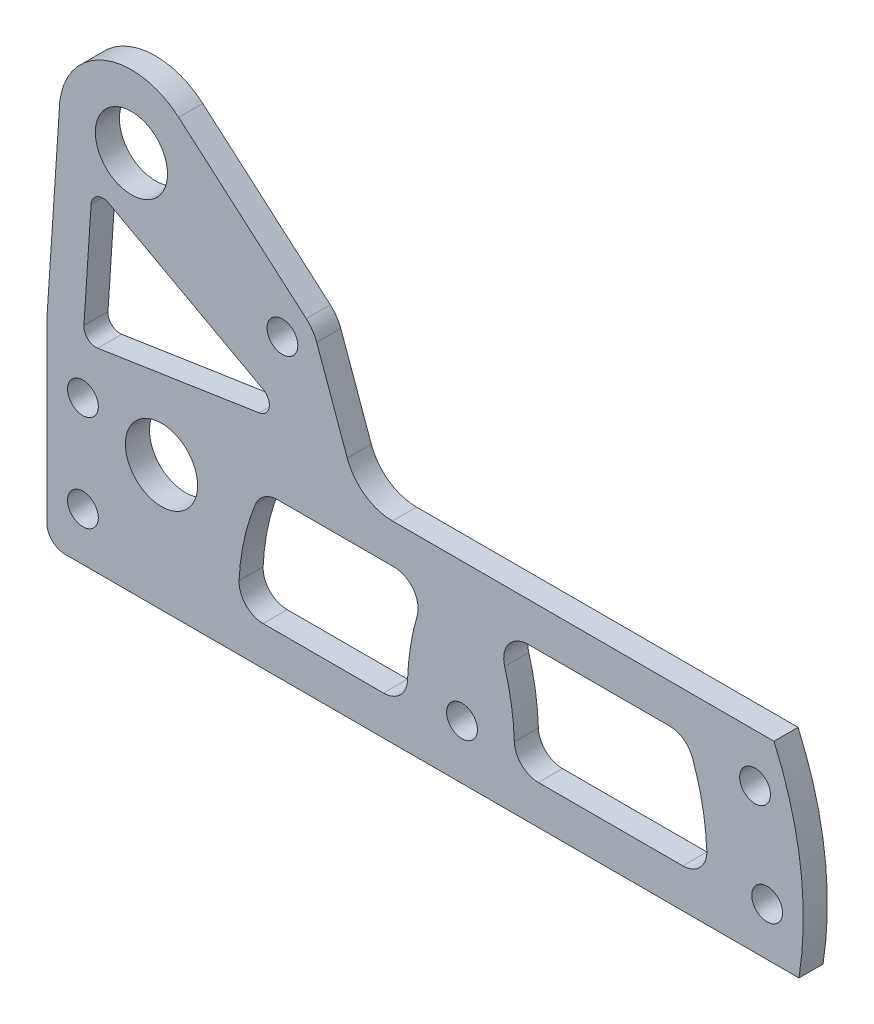
from build123d import *

# Parameters (mm, degrees)
SKETCH1_R           = 2.032
SKETCH1_R_2         = 4.7625
BOSS_EXTRUDE1_DEPTH = 3.175
FILLET1_R           = 6.35
SKETCH2_R           = 2.032
CUT_EXTRUDE1_DEPTH  = 116.854784776
FILLET2_R           = 2.3876
CUT_EXTRUDE2_REACH  = 117.855
FILLET3_R           = 3.175


with BuildPart() as part:
    # Sketch1 → Boss-Extrude1 (new body)
    with BuildSketch(Plane.XY):
        with BuildLine():
            Line((0, 0), (-99.21875, 0))
            Line((-99.21875, 0), (-99.21875, 25.4))
            ThreePointArc((-99.21875, 25.4), (-99.216112514, 25.559225204), (-99.208202949, 25.718275702))
            Line((-99.208202949, 25.718275702), (-97.583411312, 50.206818816))
            ThreePointArc((-97.583411312, 50.206818816), (-92.015151864, 58.871103506), (-81.820717516, 57.405207601))
            Line((-81.820717516, 57.405207601), (-64.992407125, 42.82279889))
            ThreePointArc((-64.992407125, 42.82279889), (-64.174703888, 41.906719209), (-63.615743119, 40.813374148))
            Line((-63.615743119, 40.813374148), (-58.084627995, 25.4))
            Line((-58.084627995, 25.4), (-3.297296565, 25.4))
            ThreePointArc((-3.297296565, 25.4), (0.195780415, 12.939434189), (0, 0))
        make_face()
        with Locations((-44.45, 7.14375)):
            Circle(SKETCH1_R, mode=Mode.SUBTRACT)
        with Locations((-84.089661312, 16.5735)):
            Circle(SKETCH1_R_2, mode=Mode.SUBTRACT)
        with Locations((-88.058411312, 50.206818816)):
            Circle(SKETCH1_R_2, mode=Mode.SUBTRACT)
        with Locations((-4.19910616, 6.35)):
            Circle(SKETCH1_R, mode=Mode.SUBTRACT)
        with Locations((-5.795027999, 19.05)):
            Circle(SKETCH1_R, mode=Mode.SUBTRACT)
        with Locations((-94.45625, 6.35)):
            Circle(SKETCH1_R, mode=Mode.SUBTRACT)
        with Locations((-94.45625, 19.05)):
            Circle(SKETCH1_R, mode=Mode.SUBTRACT)
    extrude(amount=BOSS_EXTRUDE1_DEPTH)

    # Fillet1
    fillet1_edges = [part.edges().sort_by_distance(p)[0] for p in [
        (-58.084627995, 25.4, 1.5875),
    ]]
    fillet(fillet1_edges, radius=FILLET1_R)

    # Sketch2 → Cut-Extrude1 (cut, through all)
    with BuildSketch(Plane.XY.offset(3.175)):
        with Locations((-68.140747312, 39.189568816)):
            Circle(SKETCH2_R)
    extrude(amount=-CUT_EXTRUDE1_DEPTH, mode=Mode.SUBTRACT)

    # Fillet2
    fillet2_edges = [part.edges().sort_by_distance(p)[0] for p in [
        (-99.21875, 0, 1.5875),
    ]]
    fillet(fillet2_edges, radius=FILLET2_R)

    # Sketch4 → Cut-Extrude2 (cut, up to next)
    with BuildSketch(Plane(origin=(0, 0, 0), x_dir=(-1, 0, 0), z_dir=(0, 0, -1)), mode=Mode.PRIVATE) as cut_extrude2_sk1:
        with BuildLine():
            Line((14.906243411, 20.25001426), (40.306243411, 20.25001426))
            ThreePointArc((40.306243411, 20.25001426), (38.03973616, 12.863437985), (37.591162137, 5.14998574))
            Line((37.591162137, 5.14998574), (12.191162137, 5.14998574))
            ThreePointArc((12.191162137, 5.14998574), (12.63973616, 12.863437985), (14.906243411, 20.25001426))
        make_face()
    cut_extrude2_tool1 = extrude(cut_extrude2_sk1.sketch, amount=-CUT_EXTRUDE2_REACH, mode=Mode.PRIVATE) & part.part
    # Sketch4 → Cut-Extrude2 (cut, up to next)
    with BuildSketch(Plane(origin=(0, 0, 0), x_dir=(-1, 0, 0), z_dir=(0, 0, -1)), mode=Mode.PRIVATE) as cut_extrude2_sk2:
        with BuildLine():
            Line((71.210862075, 28.952720027), (92.501475834, 25.698758848))
            ThreePointArc((92.501475834, 25.698758848), (93.814902604, 26.098604816), (94.325334391, 27.37313456))
            Line((94.325334391, 27.37313456), (93.375138804, 41.6942974))
            ThreePointArc((93.375138804, 41.6942974), (92.556554604, 42.979979171), (91.032400998, 42.983652428))
            Line((91.032400998, 42.983652428), (70.691982826, 31.916450766))
            ThreePointArc((70.691982826, 31.916450766), (69.886987798, 30.248228031), (71.210862075, 28.952720027))
        make_face()
    cut_extrude2_tool2 = extrude(cut_extrude2_sk2.sketch, amount=-CUT_EXTRUDE2_REACH, mode=Mode.PRIVATE) & part.part
    # Sketch4 → Cut-Extrude2 (cut, up to next)
    with BuildSketch(Plane(origin=(0, 0, 0), x_dir=(-1, 0, 0), z_dir=(0, 0, -1)), mode=Mode.PRIVATE) as cut_extrude2_sk3:
        with BuildLine():
            Line((73.81875, 5.14998574), (51.59375, 5.14998574))
            ThreePointArc((51.59375, 5.14998574), (51.145175977, 12.863437985), (48.878668725, 20.25001426))
            Line((48.878668725, 20.25001426), (70.807625266, 20.25001426))
            ThreePointArc((70.807625266, 20.25001426), (73.317974303, 12.900366376), (73.81875, 5.14998574))
        make_face()
    cut_extrude2_tool3 = extrude(cut_extrude2_sk3.sketch, amount=-CUT_EXTRUDE2_REACH, mode=Mode.PRIVATE) & part.part
    add(cut_extrude2_tool1.solids().sort_by_distance((-25.621324, 12.7, 0))[0], mode=Mode.SUBTRACT)
    add(cut_extrude2_tool2.solids().sort_by_distance((-84.934877, 33.097306, 0))[0], mode=Mode.SUBTRACT)
    add(cut_extrude2_tool3.solids().sort_by_distance((-61.941303, 12.68386, 0))[0], mode=Mode.SUBTRACT)

    # Fillet3
    fillet3_edges = [part.edges().sort_by_distance(p)[0] for p in [
        (-70.807625266, 20.25001426, 1.5875),
        (-73.81875, 5.14998574, 1.5875),
        (-51.59375, 5.14998574, 1.5875),
        (-48.878668725, 20.25001426, 1.5875),
        (-40.306243411, 20.25001426, 1.5875),
        (-37.591162137, 5.14998574, 1.5875),
        (-12.191162137, 5.14998574, 1.5875),
        (-14.906243411, 20.25001426, 1.5875),
    ]]
    fillet(fillet3_edges, radius=FILLET3_R)


solid = part.part
